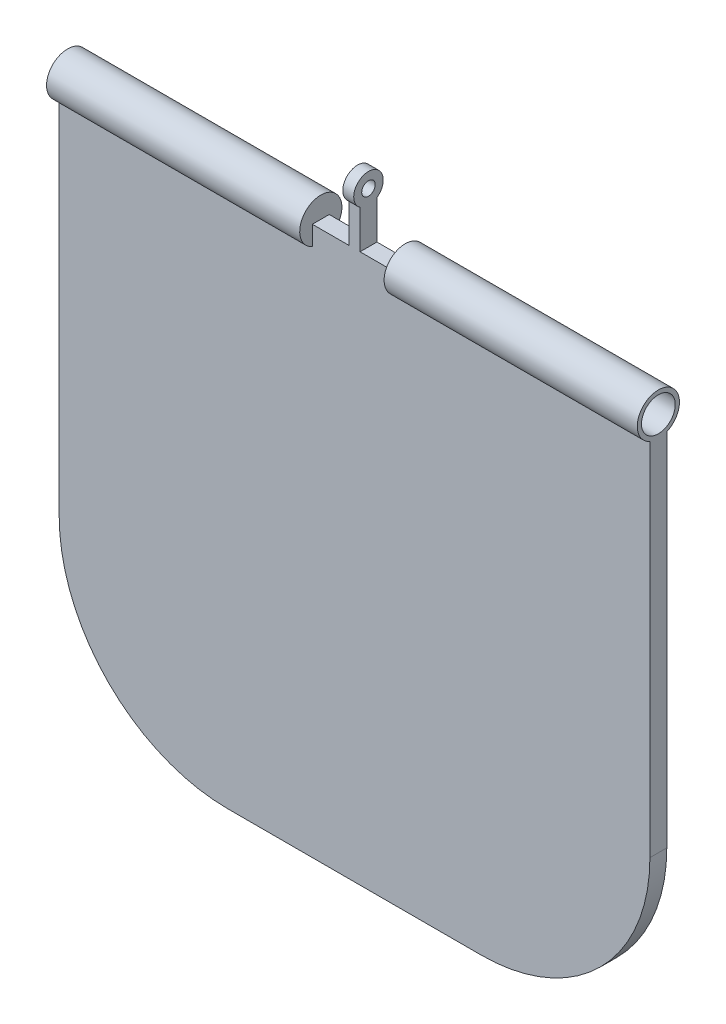
from build123d import *

# Parameters (mm, degrees)
BOSS_EXTRUDE1_DEPTH = 2
SKETCH3_R           = 2.5
BOSS_EXTRUDE2_DEPTH = 30
SKETCH3_4_R         = 2
CUT_EXTRUDE2_DEPTH  = 25
SKETCH4_R           = 0.8
BOSS_EXTRUDE3_DEPTH = 0.65


with BuildPart() as part:
    # Sketch2 → Boss-Extrude1 (new body)
    with BuildSketch(Plane.XY):
        with BuildLine():
            Line((15, -32.5), (-15, -32.5))
            ThreePointArc((-15, -32.5), (-29.142135624, -26.642135624), (-35, -12.5))
            Line((-35, -12.5), (-35, 32.5))
            Line((-35, 32.5), (35, 32.5))
            Line((35, 32.5), (35, -12.5))
            ThreePointArc((35, -12.5), (29.142135624, -26.642135624), (15, -32.5))
        make_face()
    extrude(amount=BOSS_EXTRUDE1_DEPTH)

    # Sketch3 → Boss-Extrude2 (add)
    with BuildSketch(Plane(origin=(35, 0, 0), x_dir=(0, 0, -1), z_dir=(1, 0, 0))):
        with Locations((-1, 32.5)):
            Circle(SKETCH3_R)
    boss_extrude2 = extrude(amount=-BOSS_EXTRUDE2_DEPTH)

    # Sketch3<4> → Cut-Extrude2 (cut)
    with BuildSketch(Plane(origin=(35, 0, 0), x_dir=(0, 0, -1), z_dir=(1, 0, 0))):
        with Locations((-1, 32.5)):
            Circle(SKETCH3_4_R)
    cut_extrude2 = extrude(amount=-CUT_EXTRUDE2_DEPTH, mode=Mode.SUBTRACT)

    # Mirror1: Boss-Extrude2, Cut-Extrude2 across plane
    add(boss_extrude2.mirror(Plane(origin=(0, 0, 0), x_dir=(0, 0, 1), z_dir=(1, 0, 0))))
    add(cut_extrude2.mirror(Plane(origin=(0, 0, 0), x_dir=(0, 0, 1), z_dir=(1, 0, 0))), mode=Mode.SUBTRACT)

    # Sketch4 → Boss-Extrude3 (add, symmetric)
    with BuildSketch(Plane(origin=(0, 0, 0), x_dir=(0, 0, -1), z_dir=(1, 0, 0))):
        with BuildLine():
            Line((-2, 37.063859338), (-2, 32.5))
            Line((-2, 32.5), (0, 32.5))
            Line((0, 32.5), (0, 37.063859338))
            ThreePointArc((0, 37.063859338), (-1, 40.25), (-2, 37.063859338))
        make_face()
        with Locations((-1, 38.5)):
            Circle(SKETCH4_R, mode=Mode.SUBTRACT)
    extrude(amount=BOSS_EXTRUDE3_DEPTH, both=True)


solid = part.part
